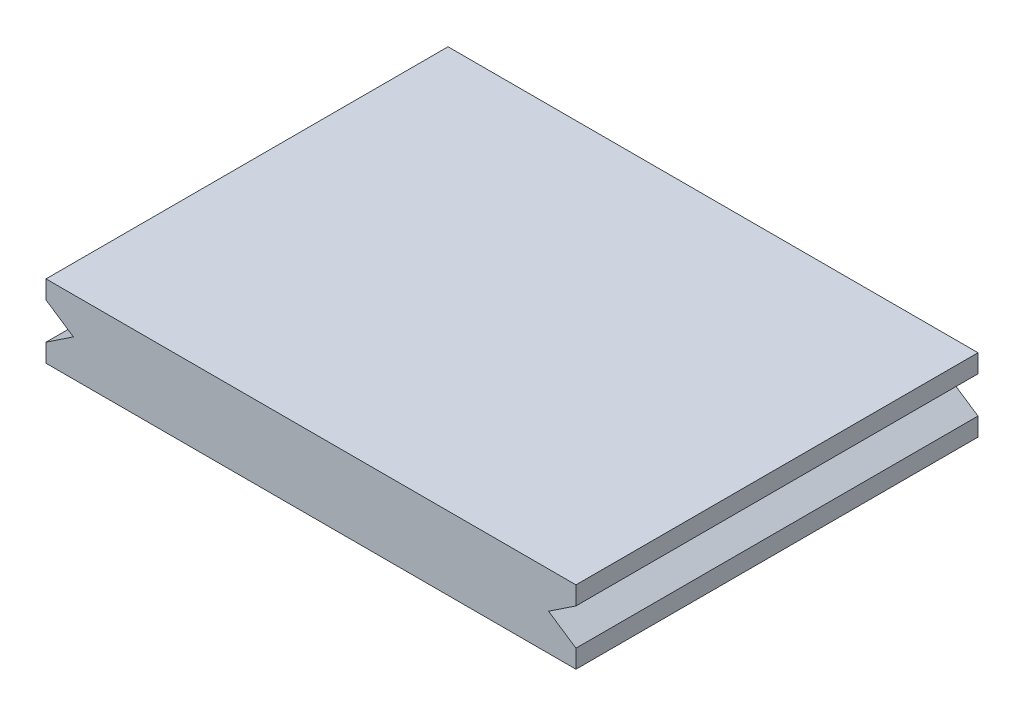
from build123d import *

# Parameters (mm, degrees)
P_IDAT_VYSUNUT_M1_DEPTH = 17.6


with BuildPart() as part:
    # Skica2 → Přidat vysunutím1 (new body)
    with BuildSketch(Plane.XY):
        Polygon((0, 1.6), (0, -1.6), (11.6, -1.6), (11.6, -0.8), (10.4, 0), (11.6, 0.8), (11.6, 1.6), align=None)
        Polygon((-10.4, 0), (-11.6, -0.8), (-11.6, -1.6), (0, -1.6), (0, 1.6), (-11.6, 1.6), (-11.6, 0.8), align=None)
    extrude(amount=P_IDAT_VYSUNUT_M1_DEPTH)


solid = part.part
